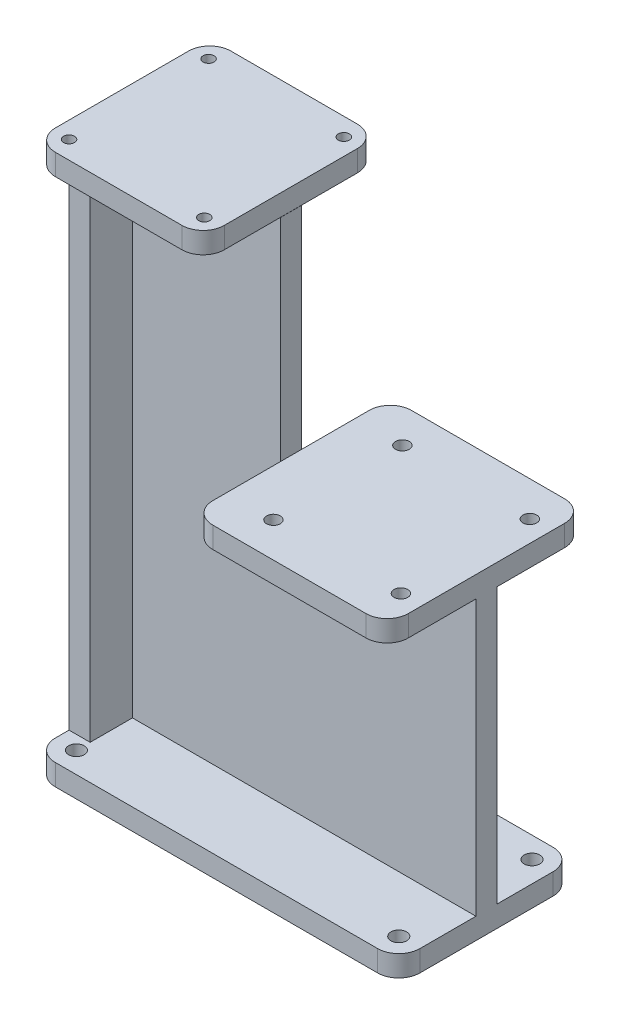
from build123d import *

# Parameters (mm, degrees)
SKT_BASE_W_MOUNTING_HOLES_R           = 1.85
EXT_BASE_PLATE_W_MOUNTING_HOLES_DEPTH = 5
SKT_UPWARD_RIDGE_W                    = 86.25
SKT_UPWARD_RIDGE_H                    = 5
EXT_UPWARD_FLANGE_DEPTH               = 65
EXT_PIX_PLATFORM_DEPTH                = 5
PIX_MOUNT_HOLES_REACH                 = 91.649
SKETCH7_R                             = 1.625
SKETCH8_W                             = 40
SKETCH8_H                             = 5
GPS_FLANGE_DEPTH                      = 55
SKETCH9_R                             = 1.3
GPS_PLATFORM_DEPTH                    = 5
SKETCH10_W                            = 10
SKETCH10_H                            = 120
BRACING_DEPTH                         = 5


with BuildPart() as part:
    # Skt - Base w mounting holes → Ext - Base Plate w Mounting Holes (new body)
    with BuildSketch(Plane(origin=(0, 0, 0), x_dir=(1, 0, 0), z_dir=(0, 1, 0))):
        with BuildLine():
            Line((-38.125, 20.75), (38.125, 20.75))
            ThreePointArc((38.125, 20.75), (41.660533906, 19.285533906), (43.125, 15.75))
            Line((43.125, 15.75), (43.125, -15.75))
            ThreePointArc((43.125, -15.75), (41.660533906, -19.285533906), (38.125, -20.75))
            Line((38.125, -20.75), (-38.125, -20.75))
            ThreePointArc((-38.125, -20.75), (-41.660533906, -19.285533906), (-43.125, -15.75))
            Line((-43.125, -15.75), (-43.125, 15.75))
            ThreePointArc((-43.125, 15.75), (-41.660533906, 19.285533906), (-38.125, 20.75))
        make_face()
        with Locations(Location((-38.125, 15.75, 0), (0, 0, 270))):
            Circle(SKT_BASE_W_MOUNTING_HOLES_R, mode=Mode.SUBTRACT)
        with Locations(Location((38.125, 15.75, 0), (0, 0, 270))):
            Circle(SKT_BASE_W_MOUNTING_HOLES_R, mode=Mode.SUBTRACT)
        with Locations(Location((38.125, -15.75, 0), (0, 0, 270))):
            Circle(SKT_BASE_W_MOUNTING_HOLES_R, mode=Mode.SUBTRACT)
        with Locations(Location((-38.125, -15.75, 0), (0, 0, 270))):
            Circle(SKT_BASE_W_MOUNTING_HOLES_R, mode=Mode.SUBTRACT)
    extrude(amount=EXT_BASE_PLATE_W_MOUNTING_HOLES_DEPTH)

    # Skt - Upward Ridge → Ext - Upward Flange (add)
    with BuildSketch(Plane(origin=(0, 5, 0), x_dir=(1, 0, 0), z_dir=(0, 1, 0))):
        Rectangle(SKT_UPWARD_RIDGE_W, SKT_UPWARD_RIDGE_H)
    extrude(amount=EXT_UPWARD_FLANGE_DEPTH)

    # Skt - GPS Nest → Ext - PIX Platform (add)
    with BuildSketch(Plane(origin=(0, 70, 0), x_dir=(1, 0, 0), z_dir=(0, 1, 0))):
        with BuildLine():
            Line((1.875, 23.5), (38.125, 23.5))
            ThreePointArc((38.125, 23.5), (41.660533906, 22.035533906), (43.125, 18.5))
            Line((43.125, 18.5), (43.125, -18.5))
            ThreePointArc((43.125, -18.5), (41.660533906, -22.035533906), (38.125, -23.5))
            Line((38.125, -23.5), (1.875, -23.5))
            ThreePointArc((1.875, -23.5), (-1.660533906, -22.035533906), (-3.125, -18.5))
            Line((-3.125, -18.5), (-3.125, 18.5))
            ThreePointArc((-3.125, 18.5), (-1.660533906, 22.035533906), (1.875, 23.5))
        make_face()
    extrude(amount=EXT_PIX_PLATFORM_DEPTH)

    # Sketch7 → Pix Mount Holes (cut, up to next)
    with BuildSketch(Plane(origin=(0, 75, 0), x_dir=(1, 0, 0), z_dir=(0, 1, 0)), mode=Mode.PRIVATE) as pix_mount_holes_sk1:
        with Locations(Location((7.975, 15.25, 0), (0, 0, 270))):
            Circle(SKETCH7_R)
    pix_mount_holes_tool1 = extrude(pix_mount_holes_sk1.sketch, amount=-PIX_MOUNT_HOLES_REACH, mode=Mode.PRIVATE) & part.part
    # Sketch7 → Pix Mount Holes (cut, up to next)
    with BuildSketch(Plane(origin=(0, 75, 0), x_dir=(1, 0, 0), z_dir=(0, 1, 0)), mode=Mode.PRIVATE) as pix_mount_holes_sk2:
        with Locations(Location((38.125, 15.25, 0), (0, 0, 270))):
            Circle(SKETCH7_R)
    pix_mount_holes_tool2 = extrude(pix_mount_holes_sk2.sketch, amount=-PIX_MOUNT_HOLES_REACH, mode=Mode.PRIVATE) & part.part
    # Sketch7 → Pix Mount Holes (cut, up to next)
    with BuildSketch(Plane(origin=(0, 75, 0), x_dir=(1, 0, 0), z_dir=(0, 1, 0)), mode=Mode.PRIVATE) as pix_mount_holes_sk3:
        with Locations(Location((38.125, -15.25, 0), (0, 0, 270))):
            Circle(SKETCH7_R)
    pix_mount_holes_tool3 = extrude(pix_mount_holes_sk3.sketch, amount=-PIX_MOUNT_HOLES_REACH, mode=Mode.PRIVATE) & part.part
    # Sketch7 → Pix Mount Holes (cut, up to next)
    with BuildSketch(Plane(origin=(0, 75, 0), x_dir=(1, 0, 0), z_dir=(0, 1, 0)), mode=Mode.PRIVATE) as pix_mount_holes_sk4:
        with Locations(Location((7.975, -15.25, 0), (0, 0, 270))):
            Circle(SKETCH7_R)
    pix_mount_holes_tool4 = extrude(pix_mount_holes_sk4.sketch, amount=-PIX_MOUNT_HOLES_REACH, mode=Mode.PRIVATE) & part.part
    add(pix_mount_holes_tool1.solids().sort_by_distance((7.975, 75, -15.25))[0], mode=Mode.SUBTRACT)
    add(pix_mount_holes_tool2.solids().sort_by_distance((38.125, 75, -15.25))[0], mode=Mode.SUBTRACT)
    add(pix_mount_holes_tool3.solids().sort_by_distance((38.125, 75, 15.25))[0], mode=Mode.SUBTRACT)
    add(pix_mount_holes_tool4.solids().sort_by_distance((7.975, 75, 15.25))[0], mode=Mode.SUBTRACT)

    # Sketch8 → GPS Flange (add)
    with BuildSketch(Plane(origin=(0, 70, 0), x_dir=(1, 0, 0), z_dir=(0, 1, 0))):
        with Locations((-23.125, 0)):
            Rectangle(SKETCH8_W, SKETCH8_H)
    extrude(amount=GPS_FLANGE_DEPTH)

    # Sketch9 → GPS Platform (add)
    with BuildSketch(Plane(origin=(0, 125, 0), x_dir=(1, 0, 0), z_dir=(0, 1, 0))):
        with BuildLine():
            Line((-38.094429072, 20.75), (-8.155570928, 20.75))
            ThreePointArc((-8.155570928, 20.75), (-4.620037022, 19.285533906), (-3.155570928, 15.75))
            Line((-3.155570928, 15.75), (-3.155570928, -15.75))
            ThreePointArc((-3.155570928, -15.75), (-4.620037022, -19.285533906), (-8.155570928, -20.75))
            Line((-8.155570928, -20.75), (-38.094429072, -20.75))
            ThreePointArc((-38.094429072, -20.75), (-41.629962978, -19.285533906), (-43.094429072, -15.75))
            Line((-43.094429072, -15.75), (-43.094429072, 15.75))
            ThreePointArc((-43.094429072, 15.75), (-41.629962978, 19.285533906), (-38.094429072, 20.75))
        make_face()
        with Locations(Location((-39.125, 16.5, 0), (0, 0, 270))):
            Circle(SKETCH9_R, mode=Mode.SUBTRACT)
        with Locations(Location((-7.125, 16.5, 0), (0, 0, 270))):
            Circle(SKETCH9_R, mode=Mode.SUBTRACT)
        with Locations(Location((-7.125, -16.5, 0), (0, 0, 270))):
            Circle(SKETCH9_R, mode=Mode.SUBTRACT)
        with Locations(Location((-39.125, -16.5, 0), (0, 0, 270))):
            Circle(SKETCH9_R, mode=Mode.SUBTRACT)
    extrude(amount=GPS_PLATFORM_DEPTH)

    # Sketch10 → Bracing (add)
    with BuildSketch(Plane.ZY.offset(43.125)):
        with Locations((-7.5, 65)):
            Rectangle(SKETCH10_W, SKETCH10_H)
        with Locations((7.5, 65)):
            Rectangle(SKETCH10_W, SKETCH10_H)
    extrude(amount=-BRACING_DEPTH)


solid = part.part
